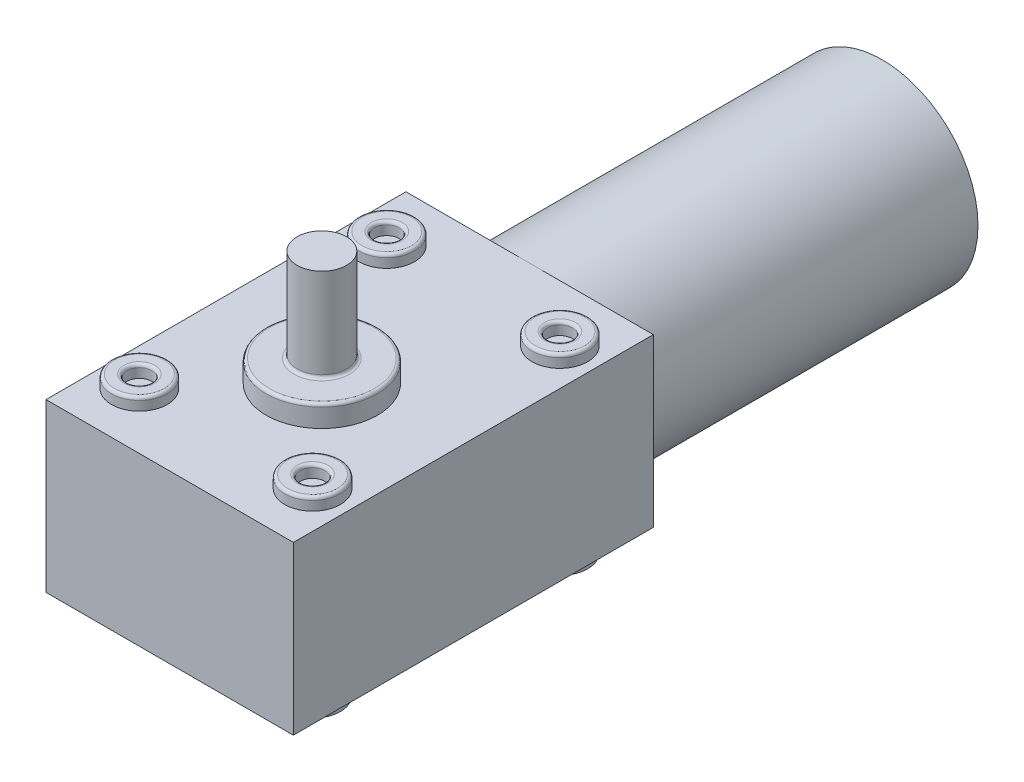
from build123d import *

# Parameters (mm, degrees)
SKETCH1_W           = 40
SKETCH1_H           = 27
BOSS_EXTRUDE1_DEPTH = 58.2
SKETCH3_R           = 15.5
BOSS_EXTRUDE2_DEPTH = 57
SKETCH4_R           = 4.5
SKETCH4_R_2         = 2
BOSS_EXTRUDE3_DEPTH = 2
SKETCH5_R           = 9
BOSS_EXTRUDE4_DEPTH = 3.5
SKETCH6_R           = 4
BOSS_EXTRUDE5_DEPTH = 15
FILLET1_R           = 0.5


with BuildPart() as part:
    # Sketch1 → Boss-Extrude1 (new body)
    with BuildSketch(Plane.XY):
        Rectangle(SKETCH1_W, SKETCH1_H)
    extrude(amount=BOSS_EXTRUDE1_DEPTH)

    # Sketch3 → Boss-Extrude2 (add)
    with BuildSketch(Plane.XY):
        with Locations((0, -2)):
            Circle(SKETCH3_R)
    extrude(amount=-BOSS_EXTRUDE2_DEPTH)

    # Sketch4 → Boss-Extrude3 (add)
    # profile 1 of 4: a face of its own
    with BuildSketch(Plane(origin=(0, 13.5, 0), x_dir=(1, 0, 0), z_dir=(0, 1, 0))):
        with Locations(Location((14, -9.1, 0), (0, 0, 90))):
            Circle(SKETCH4_R)
        with Locations(Location((14, -9.1, 0), (0, 0, 270))):
            Circle(SKETCH4_R_2, mode=Mode.SUBTRACT)
    # profile 2 of 4: a face of its own
    with BuildSketch(Plane(origin=(0, 13.5, 0), x_dir=(1, 0, 0), z_dir=(0, 1, 0))):
        with Locations(Location((-14, -9.1, 0), (0, 0, 90))):
            Circle(SKETCH4_R)
        with Locations(Location((-14, -9.1, 0), (0, 0, 270))):
            Circle(SKETCH4_R_2, mode=Mode.SUBTRACT)
    # profile 3 of 4: a face of its own
    with BuildSketch(Plane(origin=(0, 13.5, 0), x_dir=(1, 0, 0), z_dir=(0, 1, 0))):
        with Locations(Location((14, -49.1, 0), (0, 0, 90))):
            Circle(SKETCH4_R)
        with Locations(Location((14, -49.1, 0), (0, 0, 270))):
            Circle(SKETCH4_R_2, mode=Mode.SUBTRACT)
    # profile 4 of 4: a face of its own
    with BuildSketch(Plane(origin=(0, 13.5, 0), x_dir=(1, 0, 0), z_dir=(0, 1, 0))):
        with Locations(Location((-14, -49.1, 0), (0, 0, 90))):
            Circle(SKETCH4_R)
        with Locations(Location((-14, -49.1, 0), (0, 0, 270))):
            Circle(SKETCH4_R_2, mode=Mode.SUBTRACT)
    boss_extrude3 = extrude(amount=BOSS_EXTRUDE3_DEPTH)

    # Sketch5 → Boss-Extrude4 (add)
    with BuildSketch(Plane(origin=(0, 13.5, 0), x_dir=(1, 0, 0), z_dir=(0, 1, 0))):
        with Locations(Location((0, -33.6, 0), (0, 0, 90))):
            Circle(SKETCH5_R)
    boss_extrude4 = extrude(amount=BOSS_EXTRUDE4_DEPTH)

    # Sketch6 → Boss-Extrude5 (add)
    with BuildSketch(Plane(origin=(0, 17, 0), x_dir=(1, 0, 0), z_dir=(0, 1, 0))):
        with Locations(Location((0, -33.6, 0), (0, 0, 270))):
            Circle(SKETCH6_R)
    extrude(amount=BOSS_EXTRUDE5_DEPTH)

    # Fillet1
    fillet1_edges = [part.edges().sort_by_distance(p)[0] for p in [
        (14, 15.5, 13.6),
        (14, 15.5, 7.1),
        (-14, 15.5, 13.6),
        (-14, 15.5, 7.1),
        (14, 15.5, 53.6),
        (14, 15.5, 47.1),
        (-14, 15.5, 53.6),
        (-14, 15.5, 47.1),
        (0, 17, 42.6),
        (0, 17, 29.6),
    ]]
    fillet(fillet1_edges, radius=FILLET1_R)

    # Mirror2: Boss-Extrude3, Boss-Extrude4 across plane
    add(boss_extrude3.mirror(Plane.ZX))
    add(boss_extrude4.mirror(Plane.ZX))


solid = part.part
